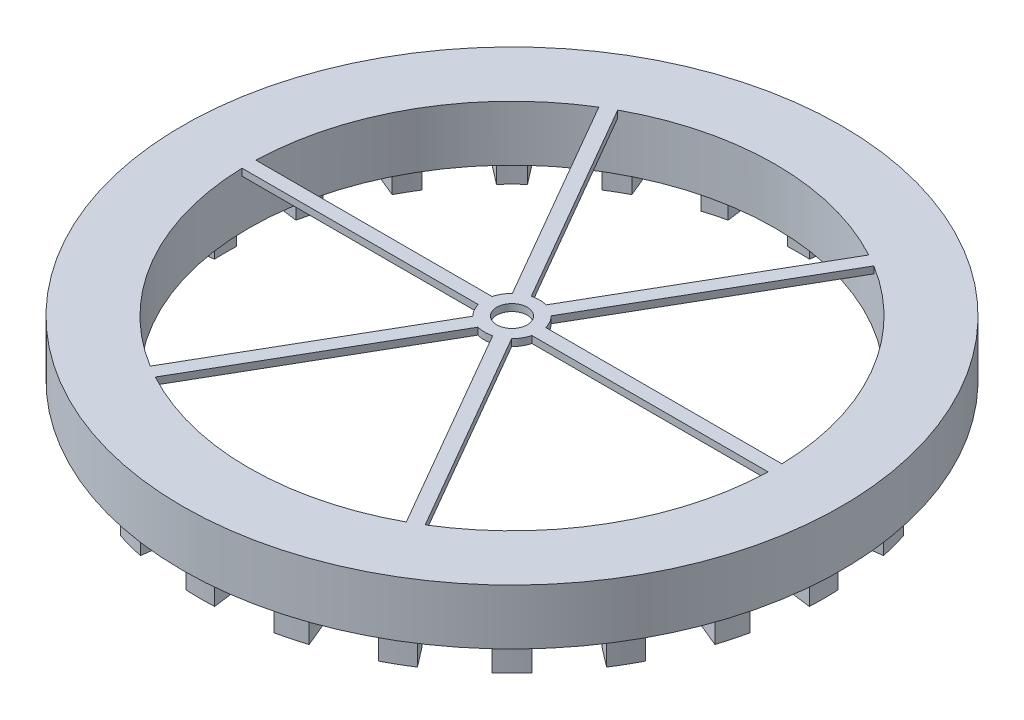
from build123d import *

# Parameters (mm, degrees)
SKETCH1_R           = 119
SKETCH1_R_2         = 5.5
BOSS_EXTRUDE1_DEPTH = 10
BOSS_EXTRUDE2_DEPTH = 12
BOSS_EXTRUDE3_START = 10
SKETCH5_R           = 20
SKETCH5_R_2         = 5.5
BOSS_EXTRUDE3_DEPTH = 10
CUT_EXTRUDE5_DEPTH  = 64
SKETCH7_R           = 95
CUT_EXTRUDE6_DEPTH  = 17.5


with BuildPart() as part:
    # Sketch1 → Boss-Extrude1 (new, symmetric)
    with BuildSketch(Plane(origin=(0, 0, 0), x_dir=(1, 0, 0), z_dir=(0, 1, 0))):
        with Locations(Location((0, 0, 0), (0, 0, 270))):
            Circle(SKETCH1_R)
        with Locations(Location((0, 0, 0), (0, 0, 270))):
            Circle(SKETCH1_R_2, mode=Mode.SUBTRACT)
    extrude(amount=BOSS_EXTRUDE1_DEPTH, both=True)

    # Sketch2 → Boss-Extrude2 (add)
    with BuildSketch(Plane(origin=(0, -10, 0), x_dir=(1, 0, 0), z_dir=(0, 1, 0))):
        with BuildLine():
            Line((5.15, -112.525), (3.958544897, -103.475))
            ThreePointArc((3.958544897, -103.475), (0, -103.554904756), (-3.958544897, -103.475))
            Line((-3.958544897, -103.475), (-5.15, -112.525))
            ThreePointArc((-5.15, -112.525), (0, -112.648790372), (5.15, -112.525))
        make_face()
        with BuildLine():
            Line((-24.149095045, -110.023721685), (-22.957639942, -100.973721685))
            ThreePointArc((-22.957639942, -100.973721685), (-26.801981565, -100.026356943), (-30.604961442, -98.924628065))
            Line((-30.604961442, -98.924628065), (-34.098131056, -107.357885521))
            ThreePointArc((-34.098131056, -107.357885521), (-29.155652356, -108.81037592), (-24.149095045, -110.023721685))
        make_face()
        with BuildLine():
            Line((-51.802469171, -100.024508561), (-48.309299557, -91.591251105))
            ThreePointArc((-48.309299557, -91.591251105), (-51.777452378, -89.681178205), (-55.165700443, -87.632706208))
            Line((-55.165700443, -87.632706208), (-60.722530829, -94.874508561))
            ThreePointArc((-60.722530829, -94.874508561), (-56.324395186, -97.556714167), (-51.802469171, -100.024508561))
        make_face()
        with BuildLine():
            Line((-75.92559063, -83.208790476), (-70.368760243, -75.966988123))
            ThreePointArc((-70.368760243, -75.966988123), (-73.224375378, -73.224375378), (-75.966988123, -70.368760243))
            Line((-75.966988123, -70.368760243), (-83.208790476, -75.92559063))
            ThreePointArc((-83.208790476, -75.92559063), (-79.654723564, -79.654723564), (-75.92559063, -83.208790476))
        make_face()
        with BuildLine():
            Line((-94.874508561, -60.722530829), (-87.632706208, -55.165700443))
            ThreePointArc((-87.632706208, -55.165700443), (-89.681178205, -51.777452378), (-91.591251105, -48.309299557))
            Line((-91.591251105, -48.309299557), (-100.024508561, -51.802469171))
            ThreePointArc((-100.024508561, -51.802469171), (-97.556714167, -56.324395186), (-94.874508561, -60.722530829))
        make_face()
        with BuildLine():
            Line((-107.357885521, -34.098131056), (-98.924628065, -30.604961442))
            ThreePointArc((-98.924628065, -30.604961442), (-100.026356943, -26.801981565), (-100.973721685, -22.957639942))
            Line((-100.973721685, -22.957639942), (-110.023721685, -24.149095045))
            ThreePointArc((-110.023721685, -24.149095045), (-108.81037592, -29.155652356), (-107.357885521, -34.098131056))
        make_face()
        with BuildLine():
            Line((-112.525, -5.15), (-103.475, -3.958544897))
            ThreePointArc((-103.475, -3.958544897), (-103.554904756, 0), (-103.475, 3.958544897))
            Line((-103.475, 3.958544897), (-112.525, 5.15))
            ThreePointArc((-112.525, 5.15), (-112.648790372, 0), (-112.525, -5.15))
        make_face()
        with BuildLine():
            Line((-110.023721685, 24.149095045), (-100.973721685, 22.957639942))
            ThreePointArc((-100.973721685, 22.957639942), (-100.026356943, 26.801981565), (-98.924628065, 30.604961442))
            Line((-98.924628065, 30.604961442), (-107.357885521, 34.098131056))
            ThreePointArc((-107.357885521, 34.098131056), (-108.81037592, 29.155652356), (-110.023721685, 24.149095045))
        make_face()
        with BuildLine():
            Line((-100.024508561, 51.802469171), (-91.591251105, 48.309299557))
            ThreePointArc((-91.591251105, 48.309299557), (-89.681178205, 51.777452378), (-87.632706208, 55.165700443))
            Line((-87.632706208, 55.165700443), (-94.874508561, 60.722530829))
            ThreePointArc((-94.874508561, 60.722530829), (-97.556714167, 56.324395186), (-100.024508561, 51.802469171))
        make_face()
        with BuildLine():
            Line((-83.208790476, 75.92559063), (-75.966988123, 70.368760243))
            ThreePointArc((-75.966988123, 70.368760243), (-73.224375378, 73.224375378), (-70.368760243, 75.966988123))
            Line((-70.368760243, 75.966988123), (-75.92559063, 83.208790476))
            ThreePointArc((-75.92559063, 83.208790476), (-79.654723564, 79.654723564), (-83.208790476, 75.92559063))
        make_face()
        with BuildLine():
            Line((-60.722530829, 94.874508561), (-55.165700443, 87.632706208))
            ThreePointArc((-55.165700443, 87.632706208), (-51.777452378, 89.681178205), (-48.309299557, 91.591251105))
            Line((-48.309299557, 91.591251105), (-51.802469171, 100.024508561))
            ThreePointArc((-51.802469171, 100.024508561), (-56.324395186, 97.556714167), (-60.722530829, 94.874508561))
        make_face()
        with BuildLine():
            Line((-34.098131056, 107.357885521), (-30.604961442, 98.924628065))
            ThreePointArc((-30.604961442, 98.924628065), (-26.801981565, 100.026356943), (-22.957639942, 100.973721685))
            Line((-22.957639942, 100.973721685), (-24.149095045, 110.023721685))
            ThreePointArc((-24.149095045, 110.023721685), (-29.155652356, 108.81037592), (-34.098131056, 107.357885521))
        make_face()
        with BuildLine():
            Line((-5.15, 112.525), (-3.958544897, 103.475))
            ThreePointArc((-3.958544897, 103.475), (0, 103.554904756), (3.958544897, 103.475))
            Line((3.958544897, 103.475), (5.15, 112.525))
            ThreePointArc((5.15, 112.525), (0, 112.648790372), (-5.15, 112.525))
        make_face()
        with BuildLine():
            Line((24.149095045, 110.023721685), (22.957639942, 100.973721685))
            ThreePointArc((22.957639942, 100.973721685), (26.801981565, 100.026356943), (30.604961442, 98.924628065))
            Line((30.604961442, 98.924628065), (34.098131056, 107.357885521))
            ThreePointArc((34.098131056, 107.357885521), (29.155652356, 108.81037592), (24.149095045, 110.023721685))
        make_face()
        with BuildLine():
            Line((51.802469171, 100.024508561), (48.309299557, 91.591251105))
            ThreePointArc((48.309299557, 91.591251105), (51.777452378, 89.681178205), (55.165700443, 87.632706208))
            Line((55.165700443, 87.632706208), (60.722530829, 94.874508561))
            ThreePointArc((60.722530829, 94.874508561), (56.324395186, 97.556714167), (51.802469171, 100.024508561))
        make_face()
        with BuildLine():
            Line((75.92559063, 83.208790476), (70.368760243, 75.966988123))
            ThreePointArc((70.368760243, 75.966988123), (73.224375378, 73.224375378), (75.966988123, 70.368760243))
            Line((75.966988123, 70.368760243), (83.208790476, 75.92559063))
            ThreePointArc((83.208790476, 75.92559063), (79.654723564, 79.654723564), (75.92559063, 83.208790476))
        make_face()
        with BuildLine():
            Line((94.874508561, 60.722530829), (87.632706208, 55.165700443))
            ThreePointArc((87.632706208, 55.165700443), (89.681178205, 51.777452378), (91.591251105, 48.309299557))
            Line((91.591251105, 48.309299557), (100.024508561, 51.802469171))
            ThreePointArc((100.024508561, 51.802469171), (97.556714167, 56.324395186), (94.874508561, 60.722530829))
        make_face()
        with BuildLine():
            Line((107.357885521, 34.098131056), (98.924628065, 30.604961442))
            ThreePointArc((98.924628065, 30.604961442), (100.026356943, 26.801981565), (100.973721685, 22.957639942))
            Line((100.973721685, 22.957639942), (110.023721685, 24.149095045))
            ThreePointArc((110.023721685, 24.149095045), (108.81037592, 29.155652356), (107.357885521, 34.098131056))
        make_face()
        with BuildLine():
            Line((112.525, 5.15), (103.475, 3.958544897))
            ThreePointArc((103.475, 3.958544897), (103.554904756, 0), (103.475, -3.958544897))
            Line((103.475, -3.958544897), (112.525, -5.15))
            ThreePointArc((112.525, -5.15), (112.648790372, 0), (112.525, 5.15))
        make_face()
        with BuildLine():
            Line((110.023721685, -24.149095045), (100.973721685, -22.957639942))
            ThreePointArc((100.973721685, -22.957639942), (100.026356943, -26.801981565), (98.924628065, -30.604961442))
            Line((98.924628065, -30.604961442), (107.357885521, -34.098131056))
            ThreePointArc((107.357885521, -34.098131056), (108.81037592, -29.155652356), (110.023721685, -24.149095045))
        make_face()
        with BuildLine():
            Line((100.024508561, -51.802469171), (91.591251105, -48.309299557))
            ThreePointArc((91.591251105, -48.309299557), (89.681178205, -51.777452378), (87.632706208, -55.165700443))
            Line((87.632706208, -55.165700443), (94.874508561, -60.722530829))
            ThreePointArc((94.874508561, -60.722530829), (97.556714167, -56.324395186), (100.024508561, -51.802469171))
        make_face()
        with BuildLine():
            Line((83.208790476, -75.92559063), (75.966988123, -70.368760243))
            ThreePointArc((75.966988123, -70.368760243), (73.224375378, -73.224375378), (70.368760243, -75.966988123))
            Line((70.368760243, -75.966988123), (75.92559063, -83.208790476))
            ThreePointArc((75.92559063, -83.208790476), (79.654723564, -79.654723564), (83.208790476, -75.92559063))
        make_face()
        with BuildLine():
            Line((60.722530829, -94.874508561), (55.165700443, -87.632706208))
            ThreePointArc((55.165700443, -87.632706208), (51.777452378, -89.681178205), (48.309299557, -91.591251105))
            Line((48.309299557, -91.591251105), (51.802469171, -100.024508561))
            ThreePointArc((51.802469171, -100.024508561), (56.324395186, -97.556714167), (60.722530829, -94.874508561))
        make_face()
        with BuildLine():
            Line((34.098131056, -107.357885521), (30.604961442, -98.924628065))
            ThreePointArc((30.604961442, -98.924628065), (26.801981565, -100.026356943), (22.957639942, -100.973721685))
            Line((22.957639942, -100.973721685), (24.149095045, -110.023721685))
            ThreePointArc((24.149095045, -110.023721685), (29.155652356, -108.81037592), (34.098131056, -107.357885521))
        make_face()
    extrude(amount=-BOSS_EXTRUDE2_DEPTH)

    # Sketch5 → Boss-Extrude3 (add)
    with BuildSketch(Plane.XZ.offset(-10).offset(BOSS_EXTRUDE3_START)):
        Circle(SKETCH5_R)
        with Locations(Location((0, 0, 0), (0, 0, 90))):
            Circle(SKETCH5_R_2, mode=Mode.SUBTRACT)
    extrude(amount=-BOSS_EXTRUDE3_DEPTH)

    # Sketch6 → Cut-Extrude5 (cut)
    with BuildSketch(Plane.XZ.offset(10)):
        with BuildLine():
            ThreePointArc((7.006292692, 7.135254916), (8.660254038, 5), (9.682458366, 2.5))
            Line((9.682458366, 2.5), (94.967099566, 2.5))
            ThreePointArc((94.967099566, 2.5), (82.27241336, 47.5), (49.648613293, 80.993920748))
            Line((49.648613293, 80.993920748), (7.006292692, 7.135254916))
        make_face()
        with BuildLine():
            Line((94.967099566, -2.5), (9.682458366, -2.5))
            ThreePointArc((9.682458366, -2.5), (8.660254038, -5), (7.006292692, -7.135254916))
            Line((7.006292692, -7.135254916), (49.648613293, -80.993920748))
            ThreePointArc((49.648613293, -80.993920748), (82.27241336, -47.5), (94.967099566, -2.5))
        make_face()
        with BuildLine():
            Line((45.318486274, -83.493920748), (2.676165673, -9.635254916))
            ThreePointArc((2.676165673, -9.635254916), (0, -10), (-2.676165673, -9.635254916))
            Line((-2.676165673, -9.635254916), (-45.318486274, -83.493920748))
            ThreePointArc((-45.318486274, -83.493920748), (0, -95), (45.318486274, -83.493920748))
        make_face()
        with BuildLine():
            Line((-49.648613293, -80.993920748), (-7.006292692, -7.135254916))
            ThreePointArc((-7.006292692, -7.135254916), (-8.660254038, -5), (-9.682458366, -2.5))
            Line((-9.682458366, -2.5), (-94.967099566, -2.5))
            ThreePointArc((-94.967099566, -2.5), (-82.27241336, -47.5), (-49.648613293, -80.993920748))
        make_face()
        with BuildLine():
            Line((-94.967099566, 2.5), (-9.682458366, 2.5))
            ThreePointArc((-9.682458366, 2.5), (-8.660254038, 5), (-7.006292692, 7.135254916))
            Line((-7.006292692, 7.135254916), (-49.648613293, 80.993920748))
            ThreePointArc((-49.648613293, 80.993920748), (-82.27241336, 47.5), (-94.967099566, 2.5))
        make_face()
        with BuildLine():
            Line((-45.318486274, 83.493920748), (-2.676165673, 9.635254916))
            ThreePointArc((-2.676165673, 9.635254916), (0, 10), (2.676165673, 9.635254916))
            Line((2.676165673, 9.635254916), (45.318486274, 83.493920748))
            ThreePointArc((45.318486274, 83.493920748), (0, 95), (-45.318486274, 83.493920748))
        make_face()
    extrude(amount=-CUT_EXTRUDE5_DEPTH, mode=Mode.SUBTRACT)

    # Sketch7 → Cut-Extrude6 (cut)
    with BuildSketch(Plane(origin=(0, -10, 0), x_dir=(-1, 0, 0), z_dir=(0, -1, 0))):
        with Locations(Location((0, 0, 0), (0, 0, 90))):
            Circle(SKETCH7_R)
    extrude(amount=-CUT_EXTRUDE6_DEPTH, mode=Mode.SUBTRACT)


solid = part.part
